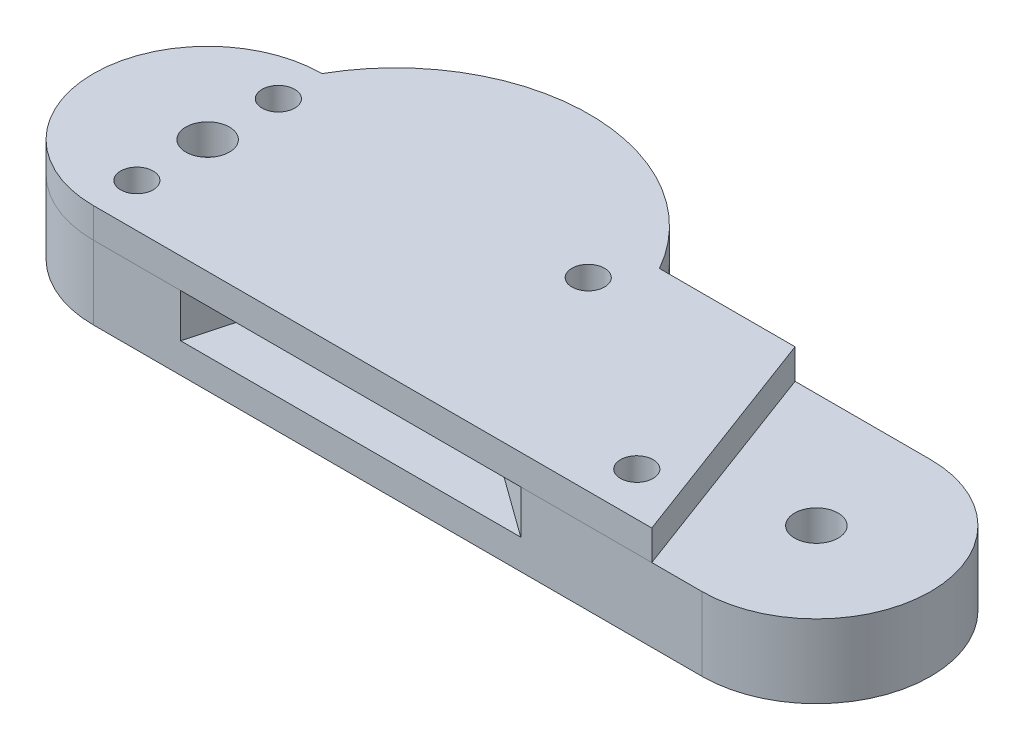
from build123d import *

# Parameters (mm, degrees)
SKETCH1_R                       = 2
BOSS_EXTRUDE1_DEPTH             = 4.75
CUT_EXTRUDE1_DEPTH              = 2
BOSS_EXTRUDE2_REACH             = 69.423
BOSS_EXTRUDE2_DIRECTION_2_REACH = 69.423
CUT_EXTRUDE2_DEPTH              = 2
SKETCH7_R                       = 1.5
CUT_EXTRUDE3_DEPTH              = 70.897349716
SKETCH8_R                       = 2.75
CUT_EXTRUDE4_DEPTH              = 3.2
CUT_EXTRUDE5_DEPTH              = 2.75


with BuildPart() as part:
    # Sketch1 → Boss-Extrude1 (new, symmetric)
    with BuildSketch(Plane(origin=(0, 0, 0), x_dir=(1, 0, 0), z_dir=(0, 1, 0))):
        with BuildLine():
            Line((0, -10.500399217), (-55.93053828, -10.500399217))
            ThreePointArc((-55.93053828, -10.500399217), (-66.430937497, 0), (-55.93053828, 10.500399217))
            Line((-55.93053828, 10.500399217), (0, 10.500399217))
            ThreePointArc((0, 10.500399217), (10.500399217, 0), (0, -10.500399217))
        make_face()
        with Locations(Location((0, 0, 0), (0, 0, 270))):
            Circle(SKETCH1_R, mode=Mode.SUBTRACT)
        with Locations(Location((-55.93053828, 0, 0), (0, 0, 270))):
            Circle(SKETCH1_R, mode=Mode.SUBTRACT)
    extrude(amount=BOSS_EXTRUDE1_DEPTH, both=True)

    # Sketch3 → Cut-Extrude1 (cut, symmetric)
    with BuildSketch(Plane(origin=(0, 0, 0), x_dir=(1, 0, 0), z_dir=(0, 1, 0))):
        with BuildLine():
            Line((-35.751827911, 18.875253657), (-39.299525946, 5.868950542))
            Line((-39.299525946, 5.868950542), (26.645239155, -41.810424095))
            ThreePointArc((26.645239155, -41.810424095), (-18.563858299, -45.972421055), (-48.206523525, -11.584965354))
            Line((-48.206523525, -11.584965354), (-43.887265107, 4.249974277))
            Line((-43.887265107, 4.249974277), (-54.812276631, 12.148974547))
            ThreePointArc((-54.812276631, 12.148974547), (-46.585078234, 19.204535889), (-35.751827911, 18.875253657))
        make_face()
    extrude(amount=CUT_EXTRUDE1_DEPTH, both=True, mode=Mode.SUBTRACT)

    # Boss-Extrude2: up to this face of the body (flat: up to its plane)
    boss_extrude2_end = Plane(part.part.faces().sort_by_distance((-27.96526914, 4.75, 0))[0])
    # Sketch5 → Boss-Extrude2 (add, up to the picked face)
    with BuildSketch(Plane(origin=(0, 0, 0), x_dir=(1, 0, 0), z_dir=(0, 1, 0)), mode=Mode.PRIVATE) as boss_extrude2_sk1:
        with BuildLine():
            ThreePointArc((-24.917700351, 10.500399217), (-40.424119316, 19.553005923), (-55.93053828, 10.500399217))
            Line((-55.93053828, 10.500399217), (-24.917700351, 10.500399217))
        make_face()
    boss_extrude2_tool1 = split(extrude(boss_extrude2_sk1.sketch, amount=BOSS_EXTRUDE2_REACH, mode=Mode.PRIVATE), bisect_by=boss_extrude2_end, keep=Keep.BOTH, mode=Mode.PRIVATE)
    add(boss_extrude2_tool1.solids().sort_by(Axis((-40.424119, 0, -14.214125), (0, 1, 0)))[0])

    # Boss-Extrude2 direction 2: up to this face of the body (flat: up to its plane)
    boss_extrude2_direction_2_end = Plane(part.part.faces().sort_by_distance((-27.96526914, -4.75, 0))[0])
    # Sketch5 → Boss-Extrude2 direction 2 (add, up to the picked face)
    with BuildSketch(Plane(origin=(0, 0, 0), x_dir=(1, 0, 0), z_dir=(0, 1, 0)), mode=Mode.PRIVATE) as boss_extrude2_direction_2_sk1:
        with BuildLine():
            ThreePointArc((-24.917700351, 10.500399217), (-40.424119316, 19.553005923), (-55.93053828, 10.500399217))
            Line((-55.93053828, 10.500399217), (-24.917700351, 10.500399217))
        make_face()
    boss_extrude2_direction_2_tool1 = split(extrude(boss_extrude2_direction_2_sk1.sketch, amount=-BOSS_EXTRUDE2_DIRECTION_2_REACH, mode=Mode.PRIVATE), bisect_by=boss_extrude2_direction_2_end, keep=Keep.BOTH, mode=Mode.PRIVATE)
    add(boss_extrude2_direction_2_tool1.solids().sort_by(Axis((-40.424119, 0, -14.214125), (0, -1, 0)))[0])

    # Sketch6 → Cut-Extrude2 (cut, symmetric)
    with BuildSketch(Plane(origin=(0, 0, 0), x_dir=(1, 0, 0), z_dir=(0, 1, 0))):
        with BuildLine():
            Line((-39.299525946, 5.868950542), (-16.659276721, -10.500399217))
            Line((-16.659276721, -10.500399217), (-47.910689027, -10.500399217))
            Line((-47.910689027, -10.500399217), (-43.887265107, 4.249974277))
            Line((-43.887265107, 4.249974277), (-54.854382526, 12.179417945))
            ThreePointArc((-54.854382526, 12.179417945), (-46.349897212, 18.538096729), (-35.738154791, 18.925381021))
            Line((-35.738154791, 18.925381021), (-39.299525946, 5.868950542))
        make_face()
    extrude(amount=CUT_EXTRUDE2_DEPTH, both=True, mode=Mode.SUBTRACT)

    # Sketch7 → Cut-Extrude3 (cut, through all)
    with BuildSketch(Plane.XZ.offset(4.75)):
        with Locations(Location((-27.461551073, -6.500399217, 0), (0, 0, 270))):
            Circle(SKETCH7_R)
        with Locations(Location((-10, 6.500399217, 0), (0, 0, 270))):
            Circle(SKETCH7_R)
        with Locations(Location((-55.93053828, 6.500399217, 0), (0, 0, 270))):
            Circle(SKETCH7_R)
        with Locations(Location((-55.93053828, -6.500399217, 0), (0, 0, 270))):
            Circle(SKETCH7_R)
    extrude(amount=-CUT_EXTRUDE3_DEPTH, mode=Mode.SUBTRACT)

    # Sketch8 → Cut-Extrude4 (cut)
    with BuildSketch(Plane.XZ.offset(4.75)):
        with Locations(Location((-55.93053828, 6.500399217, 0), (0, 0, 270))):
            Circle(SKETCH8_R)
        with Locations(Location((-55.93053828, -6.500399217, 0), (0, 0, 270))):
            Circle(SKETCH8_R)
        with Locations(Location((-27.461551073, -6.500399217, 0), (0, 0, 270))):
            Circle(SKETCH8_R)
        with Locations(Location((-10, 6.500399217, 0), (0, 0, 270))):
            Circle(SKETCH8_R)
    extrude(amount=-CUT_EXTRUDE4_DEPTH, mode=Mode.SUBTRACT)

    # Sketch9 → Cut-Extrude5 (cut)
    with BuildSketch(Plane(origin=(0, 4.75, 0), x_dir=(1, 0, 0), z_dir=(0, 1, 0))):
        with BuildLine():
            Line((-12.458850176, 10.500399217), (-4.619547141, -10.500399217))
            Line((-4.619547141, -10.500399217), (0, -10.500399217))
            ThreePointArc((0, -10.500399217), (10.500399217, 0), (0, 10.500399217))
            Line((0, 10.500399217), (-12.458850176, 10.500399217))
        make_face()
    extrude(amount=-CUT_EXTRUDE5_DEPTH, mode=Mode.SUBTRACT)


with BuildPart() as body_2:
    # Split1: the piece on the far side of the plane
    add(part.part)
    split(bisect_by=Plane(origin=(0, 2, 0), x_dir=(0, 0, -1), z_dir=(0, -1, 0)), keep=Keep.BOTTOM)


with BuildPart() as part_1:
    add(part.part)

    # Split1
    split(bisect_by=Plane(origin=(0, 2, 0), x_dir=(0, 0, -1), z_dir=(0, -1, 0)), keep=Keep.TOP)


solid = Compound([body_2.part, part_1.part])
